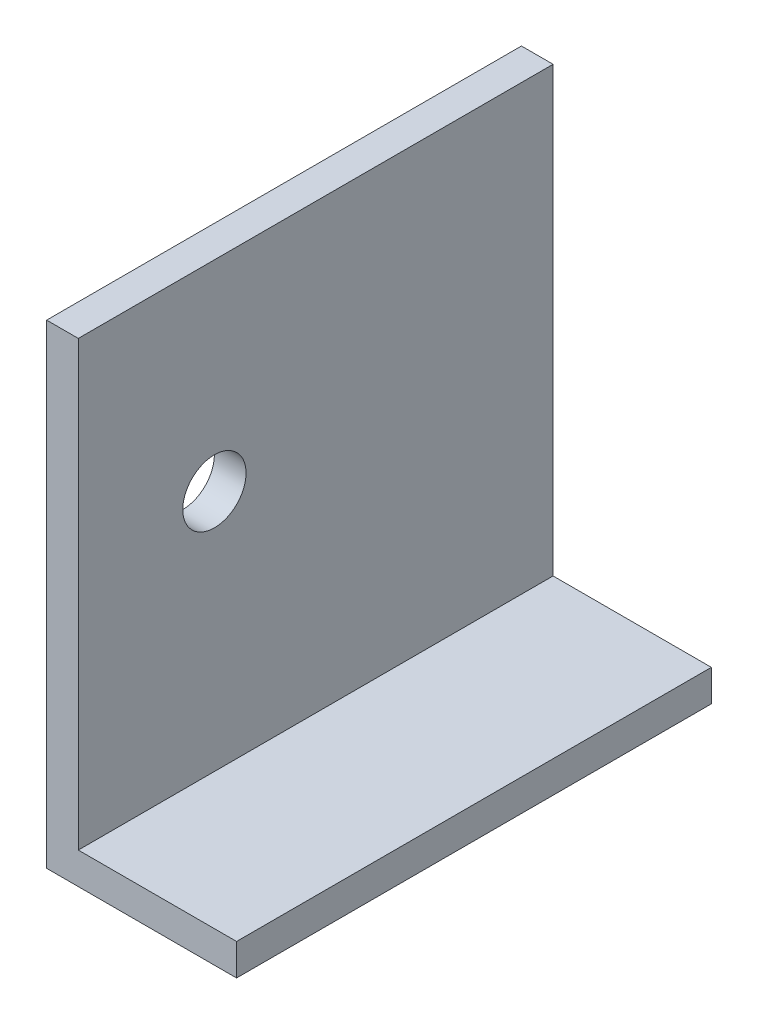
from build123d import *

# Parameters (mm, degrees)
SKETCH_1_W          = 15
SKETCH_1_H          = 3
EXTRUDE_1_DEPTH     = 45
SKETCH_2_R          = 3
CUT_EXTRUDE_1_DEPTH = 64.5


with BuildPart() as part:
    # 草图1 → 凸台-拉伸1 (new body)
    with BuildSketch(Plane.XY):
        Polygon((3, 45), (0, 45), (0, 0), (3, 0), (3, 3), align=None)
        with Locations((10.5, 1.5)):
            Rectangle(SKETCH_1_W, SKETCH_1_H)
    extrude(amount=EXTRUDE_1_DEPTH)

    # 草图2 → 切除-拉伸1 (cut)
    with BuildSketch(Plane(origin=(3, 0, 0), x_dir=(0, 0, -1), z_dir=(1, 0, 0))):
        with Locations(Location((-32.1, 26, 0), (0, 0, 90))):
            Circle(SKETCH_2_R)
    extrude(amount=-CUT_EXTRUDE_1_DEPTH, mode=Mode.SUBTRACT)


solid = part.part
